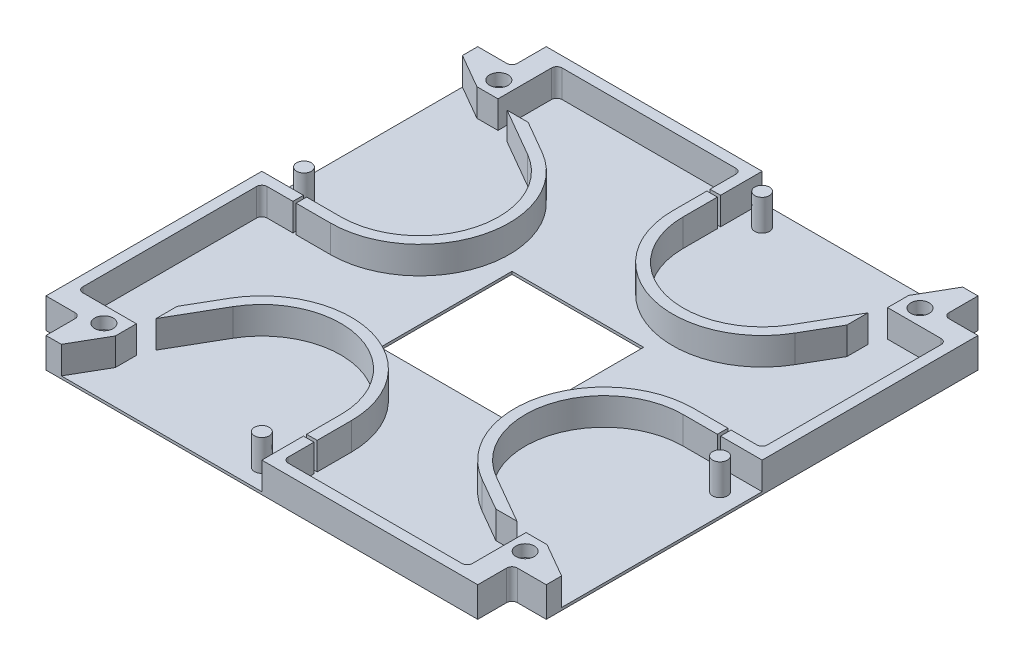
from build123d import *

# Parameters (mm, degrees)
BOSS_EXTRUDE1_DEPTH              = 0.5
BOSS_EXTRUDE2_DEPTH              = 5.2
CIRPATTERN1_COUNT                = 4
SKETCH8_R                        = 1.4
BOSS_EXTRUDE4_DEPTH              = 5.9
CIRPATTERN2_COUNT                = 4
FILLET1_R                        = 1
SKETCH11_W                       = 25
SKETCH11_H                       = 25
CUT_EXTRUDE2_DEPTH               = 126.311013881
SKETCH15_R                       = 0.9
CUT_EXTRUDE3_DEPTH               = 126.301756572
SKETCH16_R                       = 1.75
CUT_EXTRUDE4_DEPTH               = 2.3
CBORE_FOR_M1_6_SHCS2_D           = 1.8
CBORE_FOR_M1_6_SHCS2_CBORE_D     = 3.5
CBORE_FOR_M1_6_SHCS2_CBORE_DEPTH = 1.6
SKETCH20_W                       = 0.6
SKETCH20_H                       = 2
CUT_EXTRUDE6_DEPTH               = 5.2
CIRPATTERN3_COUNT                = 4
FILLET2_R                        = 1


with BuildPart() as part:
    # Sketch1 → Boss-Extrude1 (new body)
    with BuildSketch(Plane(origin=(0, 0, 0), x_dir=(1, 0, 0), z_dir=(0, 1, 0))):
        Polygon((0, 0), (0, 6.51), (82, 6.51), (82, 0), (88.51, 0), (88.51, -82), (82, -82), (82, -88.51), (0, -88.51), (0, -82), (-6.51, -82), (-6.51, 0), align=None)
    extrude(amount=BOSS_EXTRUDE1_DEPTH)

    # Sketch2 → Boss-Extrude2 (add)
    with BuildSketch(Plane(origin=(0, 0.5, 0), x_dir=(1, 0, 0), z_dir=(0, 1, 0))):
        with BuildLine():
            Line((41, 6.51), (0, 6.51))
            Line((0, 6.51), (0, 4.51))
            Line((0, 4.51), (39, 4.51))
            Line((39, 4.51), (39, -8.49))
            ThreePointArc((39, -8.49), (51.600076233, -24.910739047), (70.722431864, -16.99))
            Line((70.722431864, -16.99), (74.335460515, -10.732050808))
            Line((74.335460515, -10.732050808), (74.335460515, -6.732050808))
            Line((74.335460515, -6.732050808), (68.990381057, -15.99))
            ThreePointArc((68.990381057, -15.99), (52.117714323, -22.978887394), (41, -8.49))
            Line((41, -8.49), (41, 6.51))
        make_face()
        Polygon((88.51, -41), (88.51, 0), (82, 0), (82, 6.51), (79.094010768, 6.51), (75.335460515, 0), (75.335460515, -4), (86.51, -4), (86.51, -41), align=None)
    boss_extrude2 = extrude(amount=BOSS_EXTRUDE2_DEPTH)

    # CirPattern1: Boss-Extrude2 ×4 about axis
    cirpattern1_axis = Axis((41, 0, 41), (0, 1, 0))
    for i in range(1, CIRPATTERN1_COUNT):
        add(boss_extrude2.rotate(cirpattern1_axis, i * 360 / CIRPATTERN1_COUNT))

    # Sketch8 → Boss-Extrude4 (add)
    with BuildSketch(Plane(origin=(0, 0.5, 0), x_dir=(1, 0, 0), z_dir=(0, 1, 0))):
        with Locations(Location((37, -84.51, 0), (0, 0, 270))):
            Circle(SKETCH8_R)
    boss_extrude4 = extrude(amount=BOSS_EXTRUDE4_DEPTH)

    # CirPattern2: Boss-Extrude4 ×4 about axis
    cirpattern2_axis = Axis((41, 0, 41), (0, 1, 0))
    for i in range(1, CIRPATTERN2_COUNT):
        add(boss_extrude4.rotate(cirpattern2_axis, i * 360 / CIRPATTERN2_COUNT))

    # Fillet1
    fillet1_edges = [part.edges().sort_by_distance(p)[0] for p in [
        (4, 3.1, -4.51),
        (78, 3.1, 86.51),
        (43, 3.1, 86.51),
        (86.51, 3.1, 39),
        (39, 3.1, -4.51),
        (86.51, 3.1, 4),
        (-4.51, 3.1, 78),
        (-4.51, 3.1, 43),
    ]]
    fillet(fillet1_edges, radius=FILLET1_R)

    # Sketch11 → Cut-Extrude2 (cut, through all)
    with BuildSketch(Plane(origin=(0, 0.5, 0), x_dir=(1, 0, 0), z_dir=(0, 1, 0))):
        with Locations((41, -41)):
            Rectangle(SKETCH11_W, SKETCH11_H)
    extrude(amount=-CUT_EXTRUDE2_DEPTH, mode=Mode.SUBTRACT)

    # Sketch15 → Cut-Extrude3 (cut, through all)
    with BuildSketch(Plane(origin=(0, 5.7, 0), x_dir=(1, 0, 0), z_dir=(0, 1, 0))):
        with Locations(Location((81, -78.5, 0), (0, 0, 270))):
            Circle(SKETCH15_R)
        with Locations(Location((78.5, -1, 0), (0, 0, 270))):
            Circle(SKETCH15_R)
        with Locations(Location((1, -3.5, 0), (0, 0, 270))):
            Circle(SKETCH15_R)
        with Locations(Location((3.5, -81, 0), (0, 0, 270))):
            Circle(SKETCH15_R)
    extrude(amount=-CUT_EXTRUDE3_DEPTH, mode=Mode.SUBTRACT)

    # Sketch16 → Cut-Extrude4 (cut)
    with BuildSketch(Plane(origin=(0, 5.7, 0), x_dir=(1, 0, 0), z_dir=(0, 1, 0))):
        with Locations(Location((78.5, -1, 0), (0, 0, 270))):
            Circle(SKETCH16_R)
        with Locations(Location((81, -78.5, 0), (0, 0, 270))):
            Circle(SKETCH16_R)
        with Locations(Location((3.5, -81, 0), (0, 0, 270))):
            Circle(SKETCH16_R)
        with Locations(Location((1, -3.5, 0), (0, 0, 270))):
            Circle(SKETCH16_R)
    extrude(amount=-CUT_EXTRUDE4_DEPTH, mode=Mode.SUBTRACT)

    # CBORE for M1.6 SHCS2 (through all)
    with Locations(Plane(origin=(81, 0, 78.5), x_dir=(0, 0, -1), z_dir=(0, -1, 0))):
        with Locations((0, 0), (77.5, -2.5), (75, -80), (-2.5, -77.5)):
            CounterBoreHole(CBORE_FOR_M1_6_SHCS2_D / 2, CBORE_FOR_M1_6_SHCS2_CBORE_D / 2, CBORE_FOR_M1_6_SHCS2_CBORE_DEPTH)

    # Sketch20 → Cut-Extrude6 (cut)
    with BuildSketch(Plane(origin=(0, 5.7, 0), x_dir=(1, 0, 0), z_dir=(0, 1, 0))):
        with Locations((80.31, -40)):
            Rectangle(SKETCH20_W, SKETCH20_H)
    cut_extrude6 = extrude(amount=-CUT_EXTRUDE6_DEPTH, mode=Mode.SUBTRACT)

    # CirPattern3: Cut-Extrude6 ×4 about axis
    cirpattern3_axis = Axis((41, 0, 41), (0, 1, 0))
    for i in range(1, CIRPATTERN3_COUNT):
        add(cut_extrude6.rotate(cirpattern3_axis, i * 360 / CIRPATTERN3_COUNT), mode=Mode.SUBTRACT)

    # Fillet2
    fillet2_edges = [part.edges().sort_by_distance(p)[0] for p in [
        (0, 2.85, 0),
        (82, 2.85, 0),
        (82, 2.85, 82),
        (0, 2.85, 82),
    ]]
    fillet(fillet2_edges, radius=FILLET2_R)


solid = part.part
